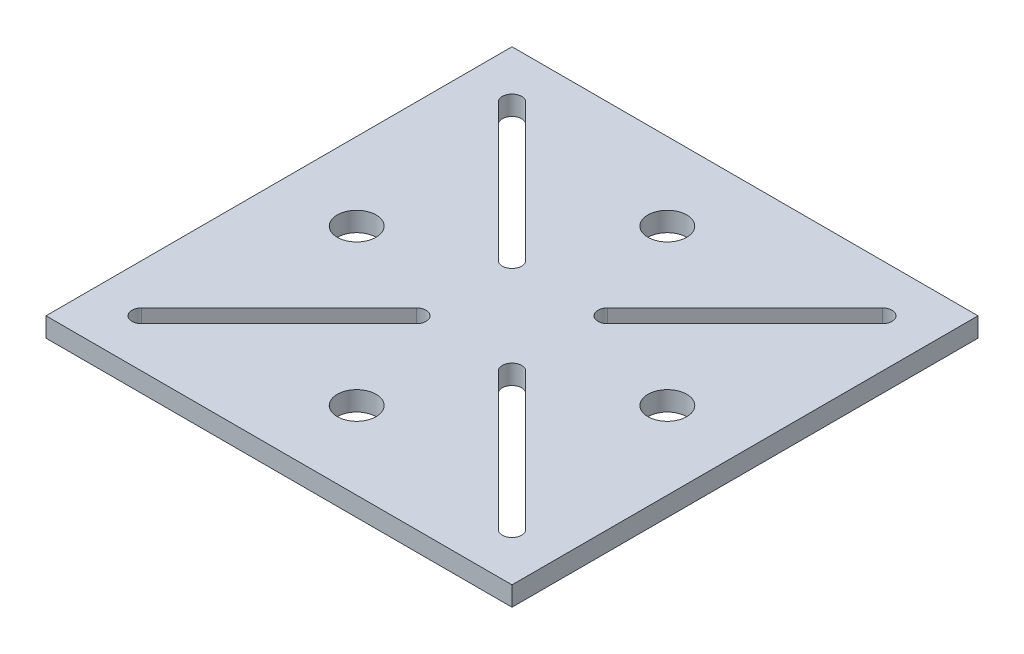
from build123d import *

# Parameters (mm, degrees)
SKETCH1_W           = 152.4
SKETCH1_H           = 152.4
SKETCH1_R           = 6.35
BOSS_EXTRUDE1_DEPTH = 6.35


with BuildPart() as part:
    # Sketch1 → Boss-Extrude1 (new body)
    with BuildSketch(Plane(origin=(0, 0, 0), x_dir=(1, 0, 0), z_dir=(0, 1, 0))):
        with Locations((76.2, 76.2)):
            Rectangle(SKETCH1_W, SKETCH1_H)
        with Locations(Location((25.4, 76.2, 0), (0, 0, 270))):
            Circle(SKETCH1_R, mode=Mode.SUBTRACT)
        with Locations(Location((76.2, 127, 0), (0, 0, 270))):
            Circle(SKETCH1_R, mode=Mode.SUBTRACT)
        with Locations(Location((127, 76.2, 0), (0, 0, 270))):
            Circle(SKETCH1_R, mode=Mode.SUBTRACT)
        with Locations(Location((76.2, 25.4, 0), (0, 0, 270))):
            Circle(SKETCH1_R, mode=Mode.SUBTRACT)
        with BuildLine():
            Line((17.894423728, 138.995704333), (62.795704333, 94.094423728))
            ThreePointArc((62.795704333, 94.094423728), (62.795704333, 89.604295667), (58.305576272, 89.604295667))
            Line((58.305576272, 89.604295667), (13.404295667, 134.505576272))
            ThreePointArc((13.404295667, 134.505576272), (13.404295667, 138.995704333), (17.894423728, 138.995704333))
        make_face(mode=Mode.SUBTRACT)
        with BuildLine():
            Line((134.505576272, 138.995704333), (89.604295667, 94.094423728))
            ThreePointArc((89.604295667, 94.094423728), (89.604295667, 89.604295667), (94.094423728, 89.604295667))
            Line((94.094423728, 89.604295667), (138.995704333, 134.505576272))
            ThreePointArc((138.995704333, 134.505576272), (138.995704333, 138.995704333), (134.505576272, 138.995704333))
        make_face(mode=Mode.SUBTRACT)
        with BuildLine():
            Line((134.505576272, 13.404295667), (89.604295667, 58.305576272))
            ThreePointArc((89.604295667, 58.305576272), (89.604295667, 62.795704333), (94.094423728, 62.795704333))
            Line((94.094423728, 62.795704333), (138.995704333, 17.894423728))
            ThreePointArc((138.995704333, 17.894423728), (138.995704333, 13.404295667), (134.505576272, 13.404295667))
        make_face(mode=Mode.SUBTRACT)
        with BuildLine():
            Line((17.894423728, 13.404295667), (62.795704333, 58.305576272))
            ThreePointArc((62.795704333, 58.305576272), (62.795704333, 62.795704333), (58.305576272, 62.795704333))
            Line((58.305576272, 62.795704333), (13.404295667, 17.894423728))
            ThreePointArc((13.404295667, 17.894423728), (13.404295667, 13.404295667), (17.894423728, 13.404295667))
        make_face(mode=Mode.SUBTRACT)
    extrude(amount=BOSS_EXTRUDE1_DEPTH)


solid = part.part
